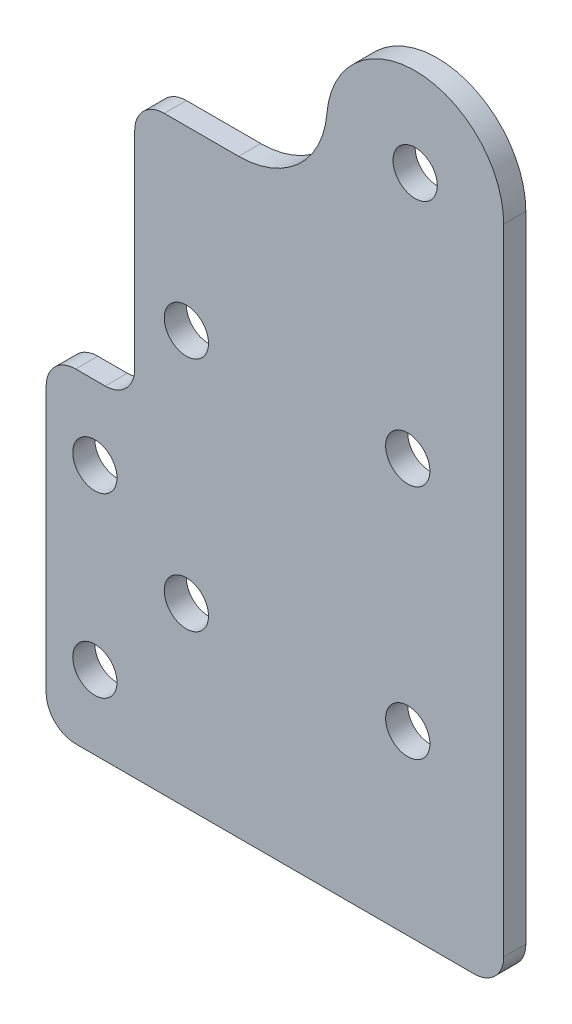
from build123d import *

# Parameters (mm, degrees)
ESQUISSE1_W             = 28
ESQUISSE1_H             = 40
ESQUISSE1_R             = 1.5
BOSS_EXTRU_1_DEPTH      = 1.5
ESQUISSE3_R             = 1.5
ESQUISSE3_W             = 3
ESQUISSE3_H             = 22
BOSS_EXTRU_2_DEPTH      = 1.5
CONG_1_R                = 6
ESQUISSE4_R             = 1.5
ESQUISSE4_W             = 6
ESQUISSE4_H             = 18
ENL_V_MAT_EXTRU_1_DEPTH = 36.387144698
CONG_2_R                = 2


with BuildPart() as part:
    # Esquisse1 → Boss.-Extru.1 (new body)
    with BuildSketch(Plane.XY):
        Rectangle(ESQUISSE1_W, ESQUISSE1_H)
        with Locations((-7.5, 8)):
            Circle(ESQUISSE1_R, mode=Mode.SUBTRACT)
        with Locations(Location((7.5, 8, 0), (0, 0, 180))):
            Circle(ESQUISSE1_R, mode=Mode.SUBTRACT)
        with Locations((7.5, -8)):
            Circle(ESQUISSE1_R, mode=Mode.SUBTRACT)
        with Locations(Location((-7.5, -8, 0), (0, 0, 180))):
            Circle(ESQUISSE1_R, mode=Mode.SUBTRACT)
    extrude(amount=BOSS_EXTRU_1_DEPTH)

    # Esquisse3 → Boss.-Extru.2 (add)
    # profile 1 of 2: a face of its own
    with BuildSketch(Plane.XY.offset(1.5)):
        with BuildLine():
            Line((2, 20), (2, 25))
            ThreePointArc((2, 25), (8, 31), (14, 25))
            Line((14, 25), (14, 20))
            ThreePointArc((14, 20), (8, 14), (2, 20))
        make_face()
        with Locations((8, 25)):
            Circle(ESQUISSE3_R, mode=Mode.SUBTRACT)
    # profile 2 of 2: a face of its own
    with BuildSketch(Plane.XY.offset(1.5)):
        with Locations((-15.5, -9)):
            Rectangle(ESQUISSE3_W, ESQUISSE3_H)
    extrude(amount=-BOSS_EXTRU_2_DEPTH)

    # Congé1
    cong_1_edges = [part.edges().sort_by_distance(p)[0] for p in [
        (2, 20, 0.75),
    ]]
    fillet(cong_1_edges, radius=CONG_1_R)

    # Esquisse4 → Enlèv. mat.-Extru.1 (cut, through all)
    with BuildSketch(Plane.XY.offset(1.5)):
        with Locations((-13.7, -3)):
            Circle(ESQUISSE4_R)
        with Locations(Location((-13.7, -15, 0), (0, 0, 180))):
            Circle(ESQUISSE4_R)
        with Locations((-14, 11)):
            Rectangle(ESQUISSE4_W, ESQUISSE4_H)
    extrude(amount=-ENL_V_MAT_EXTRU_1_DEPTH, mode=Mode.SUBTRACT)

    # Congé2
    cong_2_edges = [part.edges().sort_by_distance(p)[0] for p in [
        (-17, 2, 0.75),
        (-17, -20, 0.75),
        (14, -20, 0.75),
        (-11, 2, 0.75),
        (-11, 20, 0.75),
    ]]
    fillet(cong_2_edges, radius=CONG_2_R)


solid = part.part
